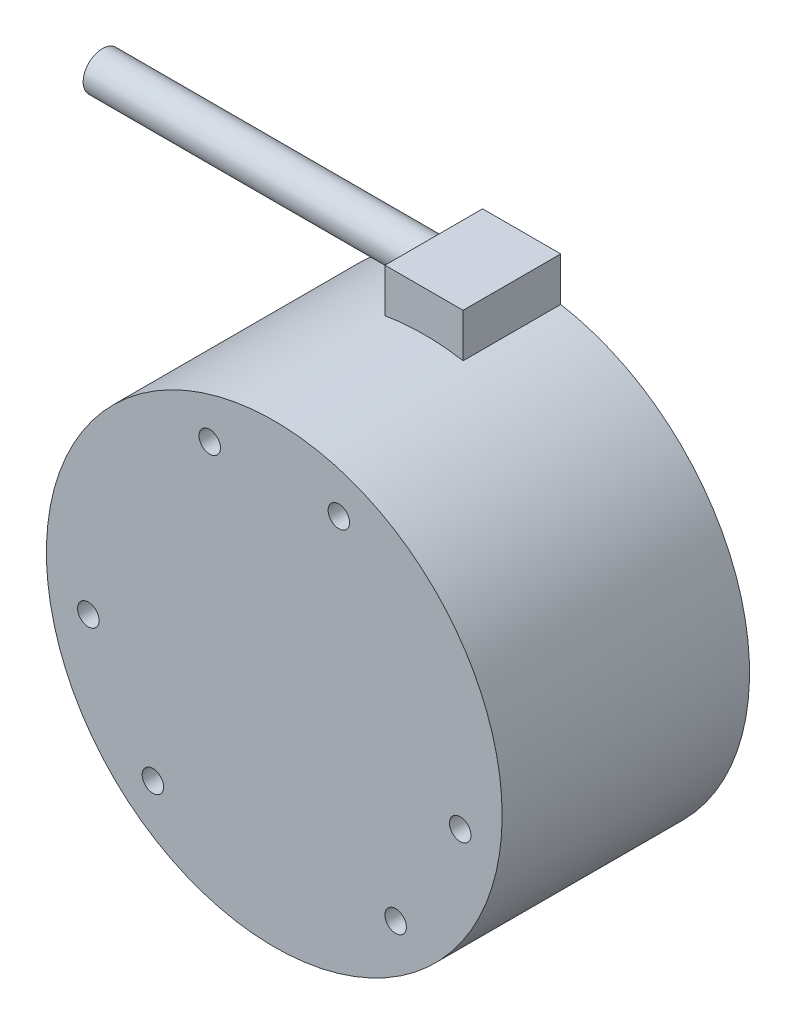
from build123d import *

# Parameters (mm, degrees)
SKETCH_1_R             = 35
EXTRUDE_1_DEPTH        = 38
SKETCH_2_W             = 12
SKETCH_2_H             = 15
EXTRUDE_2_DEPTH        = 11
SKETCH_3_R             = 2.95
EXTRUDE_3_DEPTH        = 63
HOLE_WIZARD_M4_1_D     = 3.3
HOLE_WIZARD_M4_1_DEPTH = 5
HOLE_WIZARD_M4_1_TIP   = 0.991420021


with BuildPart() as part:
    # 草图1 → 凸台-拉伸1 (new body)
    with BuildSketch(Plane.XY):
        Circle(SKETCH_1_R)
    extrude(amount=EXTRUDE_1_DEPTH)

    # 草图2 → 凸台-拉伸2 (add)
    with BuildSketch(Plane(origin=(0, 41.2, 0), x_dir=(1, 0, 0), z_dir=(0, 1, 0))):
        with Locations((0, -7.5)):
            Rectangle(SKETCH_2_W, SKETCH_2_H)
    extrude(amount=-EXTRUDE_2_DEPTH)

    # 草图3 → 凸台-拉伸3 (add)
    with BuildSketch(Plane(origin=(6, 0, 0), x_dir=(0, 0, -1), z_dir=(1, 0, 0))):
        with Locations((-7.405885861, 37.760893476)):
            Circle(SKETCH_3_R)
    extrude(amount=-EXTRUDE_3_DEPTH)

    # M4 螺纹孔的螺纹孔钻头1
    with Locations(Plane(origin=(-9.918584156, 27.251086003, 38), x_dir=(1, 0, 0), z_dir=(0, 0, 1))):
        with Locations((0, 0), (19.837168312, 0), (38.478008993, -32.286883155), (28.559424837, -49.466374853), (-8.722256525, -49.466374853), (-18.640840681, -32.286883155)):
            Hole(HOLE_WIZARD_M4_1_D / 2, depth=HOLE_WIZARD_M4_1_DEPTH)
            with Locations((0, 0, -(HOLE_WIZARD_M4_1_DEPTH + HOLE_WIZARD_M4_1_TIP / 2))):  # 118° drill point
                Cone(0, HOLE_WIZARD_M4_1_D / 2, HOLE_WIZARD_M4_1_TIP, mode=Mode.SUBTRACT)


solid = part.part
